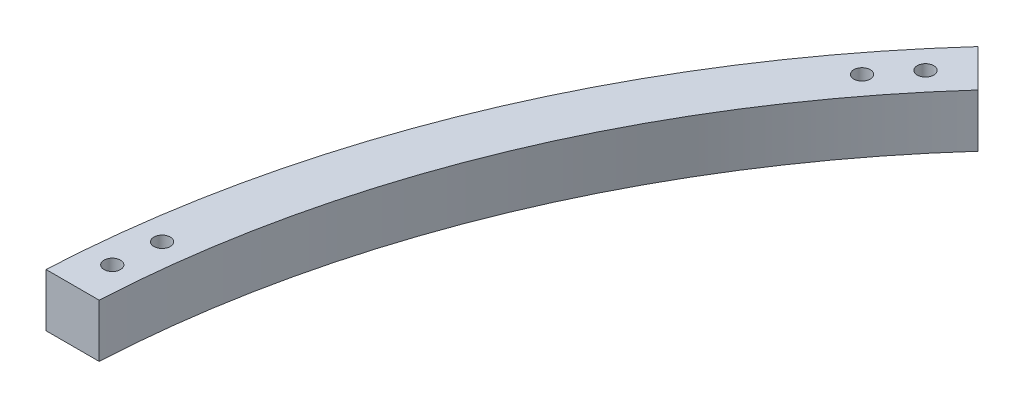
from build123d import *

# Parameters (mm, degrees)
BASE_DEPTH                 = 5
F_3_1_3_1_DIAMETER_HOLE1_D = 3.1


with BuildPart() as part:
    # Sketch1 → base (new, symmetric)
    with BuildSketch(Plane(origin=(0, 0, 0), x_dir=(1, 0, 0), z_dir=(0, 1, 0))):
        with BuildLine():
            Line((-141.235146462, 127.093010838), (-148.31553673, 134.173401106))
            ThreePointArc((-148.31553673, 134.173401106), (-184.775906502, 76.536686473), (-199.749843554, 10))
            Line((-199.749843554, 10), (-189.73665961, 10))
            ThreePointArc((-189.73665961, 10), (-175.537111177, 72.709852149), (-141.235146462, 127.093010838))
        make_face()
    extrude(amount=BASE_DEPTH, both=True)

    # Ø3.1 (3.1) Diameter Hole1 (through all)
    with Locations(Plane(origin=(0, 5, 0), x_dir=(1, 0, 0), z_dir=(0, 1, 0))):
        with Locations((-194.257966128, 16.995369836), (-149.378666408, 125.343583889), (-154.703901357, 118.708478657), (-193.331747968, 25.452607483)):
            Hole(F_3_1_3_1_DIAMETER_HOLE1_D / 2)


solid = part.part
